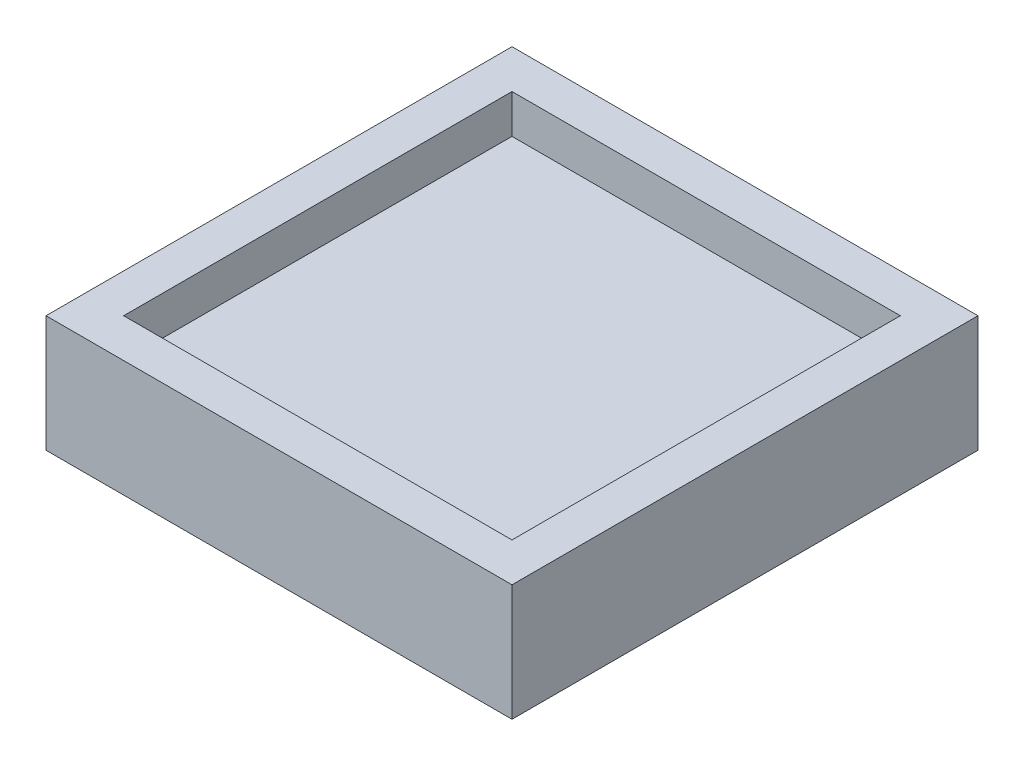
from build123d import *

# Parameters (mm, degrees)
SKETCH_2_W          = 12
SKETCH_2_H          = 3
EXTRUDE_1_DEPTH     = 12
SKETCH_3_W          = 10
SKETCH_3_H          = 10
CUT_EXTRUDE_1_DEPTH = 1


with BuildPart() as part:
    # 草图2 → 凸台-拉伸1 (new body)
    with BuildSketch(Plane.XY):
        with Locations((6, 1.5)):
            Rectangle(SKETCH_2_W, SKETCH_2_H)
    extrude(amount=EXTRUDE_1_DEPTH)

    # 草图3 → 切除-拉伸1 (cut)
    with BuildSketch(Plane(origin=(0, 3, 0), x_dir=(1, 0, 0), z_dir=(0, 1, 0))):
        with Locations((6, -6)):
            Rectangle(SKETCH_3_W, SKETCH_3_H)
    extrude(amount=-CUT_EXTRUDE_1_DEPTH, mode=Mode.SUBTRACT)


solid = part.part
